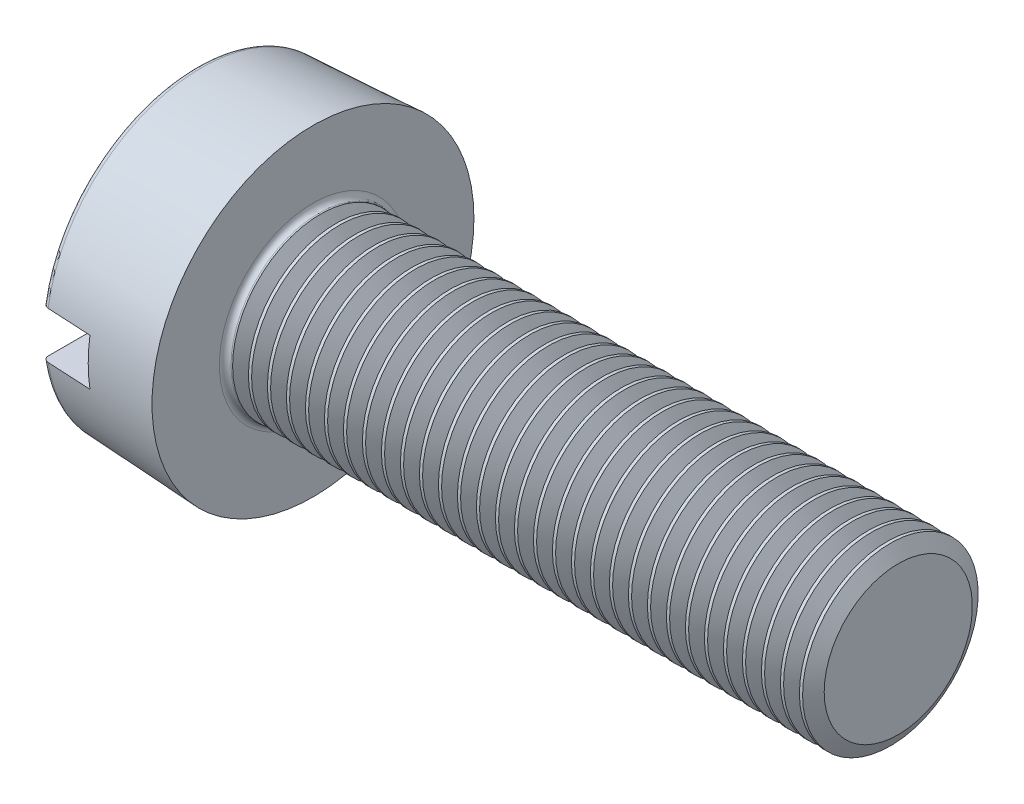
from build123d import *

# Parameters (mm, degrees)
SKETCH2_R        = 2.75
BASEHEAD_DEPTH   = 2
BASEHEAD_DRAFT   = -3
SKETCH3_R        = 1.5
BASEBODY_DEPTH   = 10
SLOT_DEPTH       = 15.912913867
SLOT_DEPTH_BACK  = 15.912913867
SKETCH4_W        = 0.8
SKETCH4_H        = 0.85
HEADFILLET_R     = 0.1
LPATTERN10_COUNT = 31
LPATTERN10_PITCH = 0.3246


with BuildPart() as part:
    # Sketch2 → BaseHead (with draft: the straight prism first)
    with BuildSketch(Plane(origin=(2, 0, 0), x_dir=(0, 0, -1), z_dir=(1, 0, 0))):
        Circle(SKETCH2_R)
    extrude(amount=-BASEHEAD_DEPTH)
    # BaseHead: the draft: its side faces are tilted about the plane it starts from
    basehead_sides = [part.faces().sort_by_distance(p)[0] for p in [
        (1, 0, 2.75),
    ]]
    draft(basehead_sides, Plane(origin=(2, 0, 0), x_dir=(0, 0, -1), z_dir=(1, 0, 0)), BASEHEAD_DRAFT)

    # Sketch3 → BaseBody (add)
    with BuildSketch(Plane(origin=(2, -1.110095321, -1.354392991), x_dir=(0, 0, -1), z_dir=(1, 0, 0))):
        with Locations((-1.354392991, 1.110095321)):
            Circle(SKETCH3_R)
    extrude(amount=BASEBODY_DEPTH)

    # Sketch4 → Slot (cut, two sides: drawn at the far end of the back side and taken through both)
    with BuildSketch(Plane(origin=(-1.9, -1.9, 0), x_dir=(0, 1, 0), z_dir=(0, 0, 1)).offset(-SLOT_DEPTH_BACK)):
        with Locations((1.9, -2.325)):
            Rectangle(SKETCH4_W, SKETCH4_H)
    extrude(amount=SLOT_DEPTH + SLOT_DEPTH_BACK, mode=Mode.SUBTRACT)

    # HeadFillet
    headfillet_edges = [part.edges().sort_by_distance(p)[0] for p in [
        (2, 0, 1.5),
        (0, -2.645184441, 0),
        (0, 2.645184441, 0),
    ]]
    fillet(headfillet_edges, radius=HEADFILLET_R)

    # Sketch5 → Cut-Revolve10 (revolve, cut)
    with BuildSketch(Plane.XY, mode=Mode.PRIVATE) as cut_revolve10_sk:
        Polygon((12.13525, 1.5), (12.13525, 1.7705), (11.86475, 1.7705), (11.86475, 1.5), (12, 1.265740128), align=None)
    cut_revolve10 = revolve(cut_revolve10_sk.sketch.rotate(Axis((0, 0, 0), (1, 0, 0)), 90), axis=Axis((0, 0, 0), (1, 0, 0)), mode=Mode.SUBTRACT)

    # LPattern10: Cut-Revolve10 ×31
    with Locations(*[(-i * LPATTERN10_PITCH, 0, 0) for i in range(1, LPATTERN10_COUNT)]):
        add(cut_revolve10, mode=Mode.SUBTRACT)


solid = part.part
